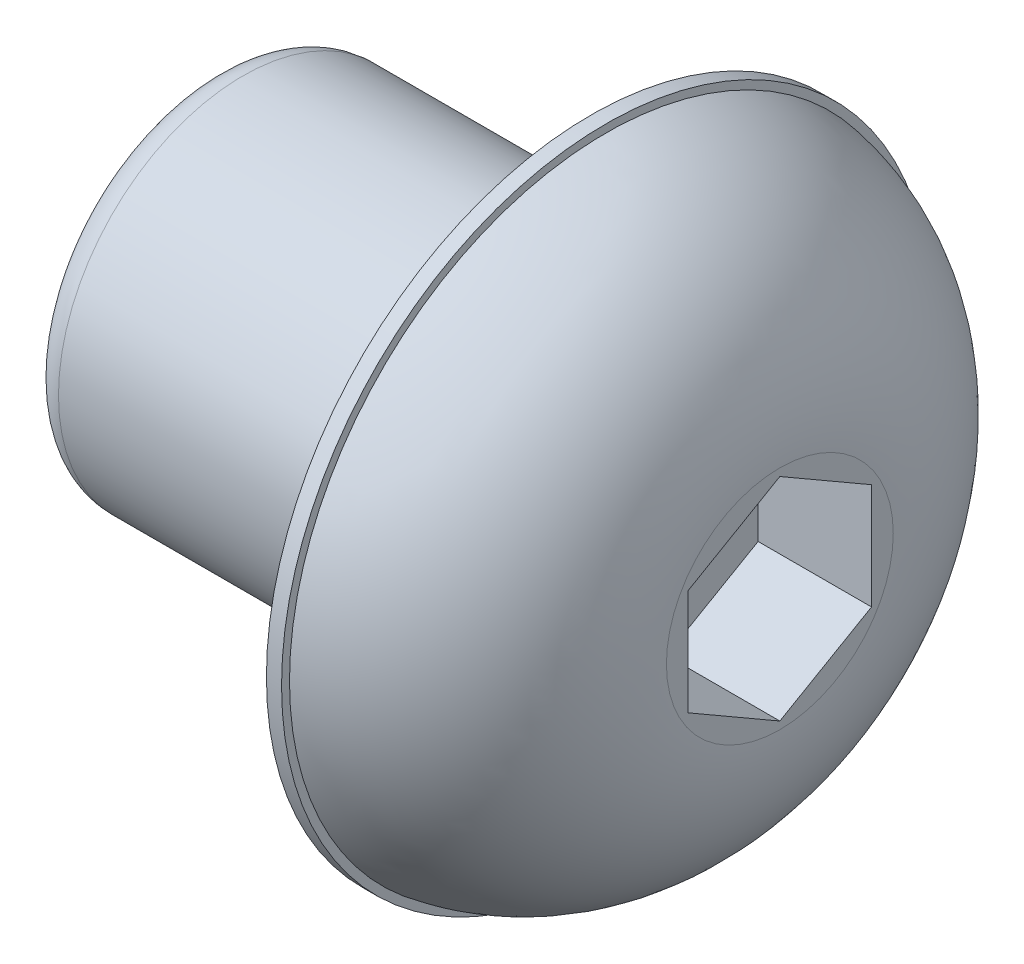
from build123d import *

# Parameters (mm, degrees)
BOSS_EXTRUDE1_START = 3.81
SKETCH2_R           = 3.81
BOSS_EXTRUDE1_DEPTH = 3.81
FILLET1_R           = 1.016


with BuildPart() as part:
    # Sketch1 → Revolve1 (revolve)
    with BuildSketch(Plane.XY, mode=Mode.PRIVATE) as revolve1_sk:
        with BuildLine():
            Line((0, 0), (0, 6.1976))
            Line((0, 6.1976), (15.24, 6.1976))
            Line((15.24, 6.1976), (15.24, 2.3876))
            Line((15.24, 2.3876), (19.05, 2.3876))
            ThreePointArc((19.05, 2.3876), (17.389827979, -2.102388864), (13.208, -4.4323))
            Line((13.208, -4.4323), (13.208, -4.699))
            Line((13.208, -4.699), (12.7, -4.699))
            Line((12.7, -4.699), (12.7, 0))
            Line((12.7, 0), (0, 0))
        make_face()
    revolve(revolve1_sk.sketch.rotate(Axis((0, 6.1976, 0), (1, 0, 0)), 270), axis=Axis((0, 6.1976, 0), (1, 0, 0)))

    # Sketch2 → Boss-Extrude1 (add)
    with BuildSketch(Plane(origin=(15.24, 0, 0), x_dir=(0, 0, -1), z_dir=(1, 0, 0)).offset(BOSS_EXTRUDE1_START)):
        with Locations((0, 6.1976)):
            Circle(SKETCH2_R)
        Polygon((0, 2.641411017), (3.07975, 4.419505508), (3.07975, 7.975694492), (0, 9.753788983), (-3.07975, 7.975694492), (-3.07975, 4.419505508), align=None, mode=Mode.SUBTRACT)
    extrude(amount=-BOSS_EXTRUDE1_DEPTH)

    # Fillet1
    fillet1_edges = [part.edges().sort_by_distance(p)[0] for p in [
        (0, 6.1976, -6.1976),
    ]]
    fillet(fillet1_edges, radius=FILLET1_R)


solid = part.part
